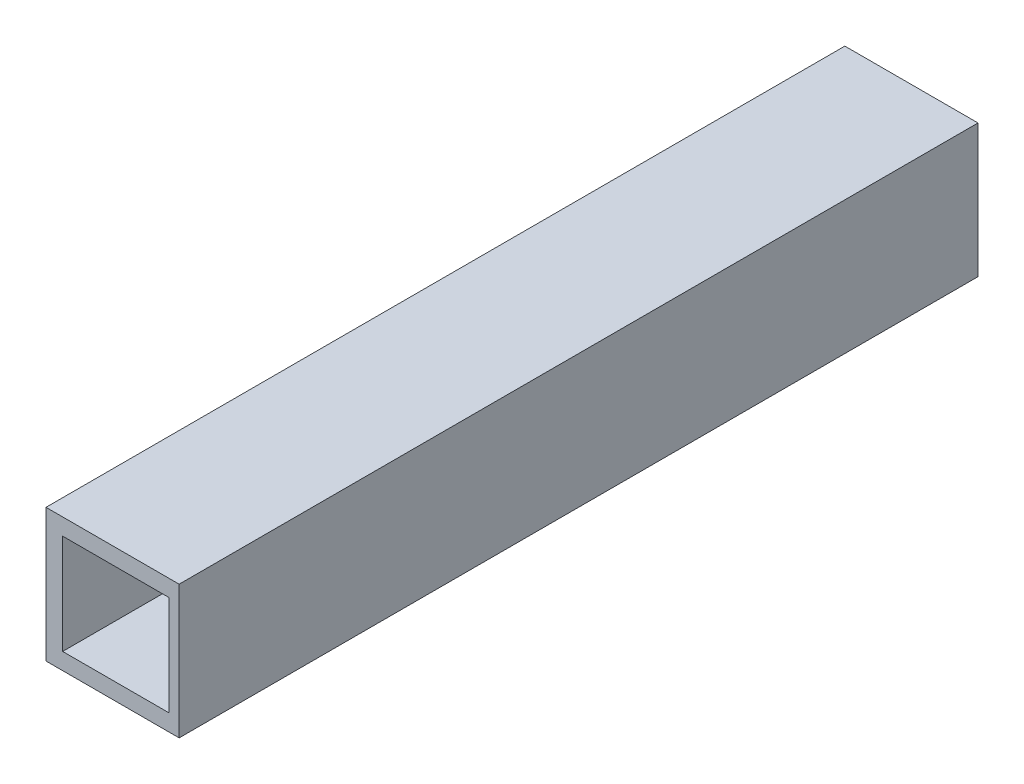
from build123d import *

# Parameters (mm, degrees)
SKETCH1_W           = 25.4
SKETCH1_H           = 25.4
BOSS_EXTRUDE2_DEPTH = 152.4
SKETCH2_W           = 20.302766191
SKETCH2_H           = 19.05
CUT_EXTRUDE1_DEPTH  = 157.576115675


with BuildPart() as part:
    # Sketch1 → Boss-Extrude2 (new body)
    with BuildSketch(Plane.XY):
        with Locations((12.7, 12.7)):
            Rectangle(SKETCH1_W, SKETCH1_H)
    extrude(amount=BOSS_EXTRUDE2_DEPTH)

    # Sketch2 → Cut-Extrude1 (cut, through all)
    with BuildSketch(Plane(origin=(0, 0, 0), x_dir=(-1, 0, 0), z_dir=(0, 0, -1))):
        with Locations((-13.326383096, 12.7)):
            Rectangle(SKETCH2_W, SKETCH2_H)
    extrude(amount=-CUT_EXTRUDE1_DEPTH, mode=Mode.SUBTRACT)


solid = part.part
